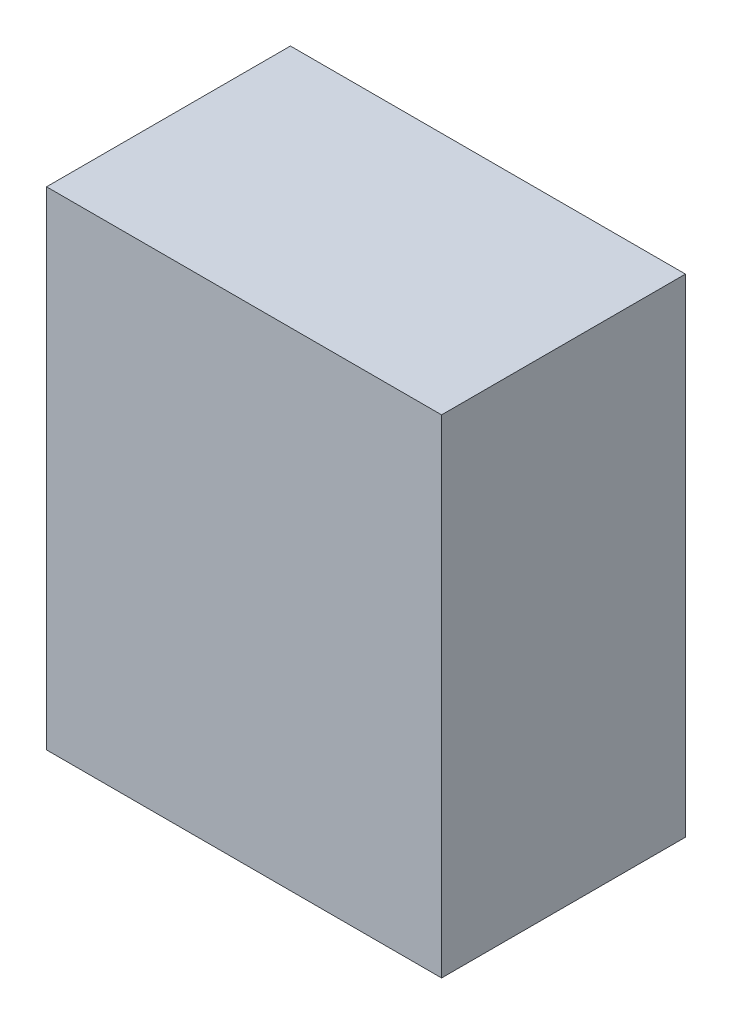
from build123d import *

# Parameters (mm, degrees)
SKETCH1_W           = 16.2
SKETCH1_H           = 20
BOSS_EXTRUDE1_DEPTH = 10


with BuildPart() as part:
    # Sketch1 → Boss-Extrude1 (new body)
    with BuildSketch(Plane.XY):
        with Locations((8.1, 10)):
            Rectangle(SKETCH1_W, SKETCH1_H)
    extrude(amount=-BOSS_EXTRUDE1_DEPTH)


solid = part.part
